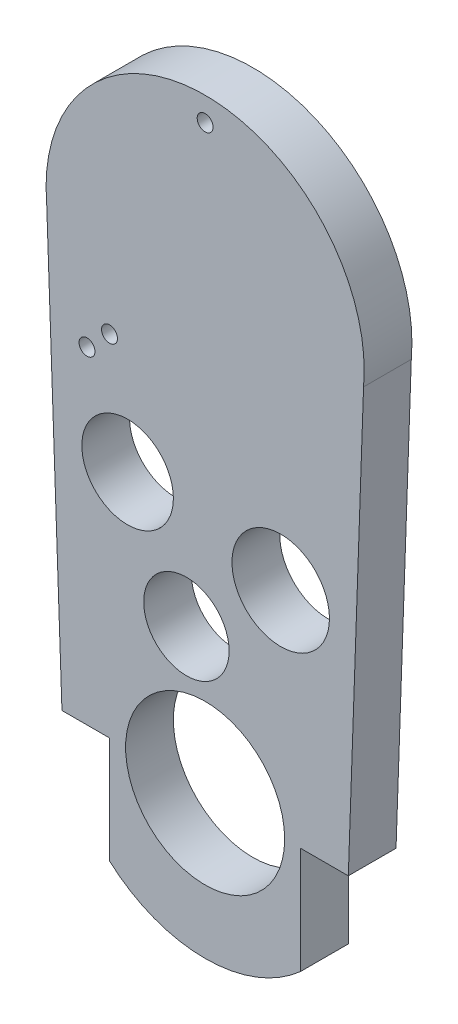
from build123d import *

# Parameters (mm, degrees)
ESQUISSE1_R        = 5
ESQUISSE1_R_2      = 2.877506478
ESQUISSE1_R_3      = 3.063484505
ESQUISSE1_R_4      = 2.684325632
ESQUISSE1_R_5      = 0.5
BOSS_EXTRU_1_DEPTH = 3


with BuildPart() as part:
    # Esquisse1 → Boss.-Extru.1 (new body)
    with BuildSketch(Plane.XY):
        with BuildLine():
            Line((6, -6.708203932), (6, 0))
            Line((6, 0), (9, 0))
            Line((9, 0), (9.959071707, 27.096179922))
            ThreePointArc((9.959071707, 27.096179922), (0, 38), (-9.959071707, 27.096179922))
            Line((-9.959071707, 27.096179922), (-9, 0))
            Line((-9, 0), (-6, 0))
            Line((-6, 0), (-6, -6.708203932))
            ThreePointArc((-6, -6.708203932), (0, -9), (6, -6.708203932))
        make_face()
        Circle(ESQUISSE1_R, mode=Mode.SUBTRACT)
        with Locations((-4.874230419, 15.048067775)):
            Circle(ESQUISSE1_R_2, mode=Mode.SUBTRACT)
        with Locations((4.750736526, 13.416152965)):
            Circle(ESQUISSE1_R_3, mode=Mode.SUBTRACT)
        with Locations((-1.177443807, 8.487104148)):
            Circle(ESQUISSE1_R_4, mode=Mode.SUBTRACT)
        with Locations((-7.424621202, 20.575378798)):
            Circle(ESQUISSE1_R_5, mode=Mode.SUBTRACT)
        with Locations((-6.01040764, 21.98959236)):
            Circle(ESQUISSE1_R_5, mode=Mode.SUBTRACT)
        with Locations((0, 36.5)):
            Circle(ESQUISSE1_R_5, mode=Mode.SUBTRACT)
    extrude(amount=BOSS_EXTRU_1_DEPTH)


solid = part.part
